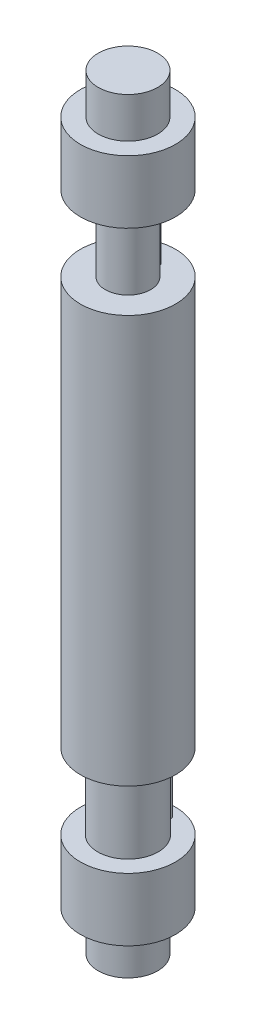
from build123d import *

# Parameters (mm, degrees)
SKETCH1_R           = 12.5
BOSS_EXTRUDE1_DEPTH = 17
SKETCH2_R           = 20
BOSS_EXTRUDE2_DEPTH = 26.425
SKETCH3_R           = 12.7
BOSS_EXTRUDE3_DEPTH = 31.75
SKETCH8_W           = 6.35
SKETCH8_H           = 3.175
BOSS_EXTRUDE8_DEPTH = 31.75
SKETCH4_R           = 20
BOSS_EXTRUDE4_DEPTH = 171.45
SKETCH5_R           = 9.525
BOSS_EXTRUDE5_DEPTH = 31.75
SKETCH9_W           = 4.7625
SKETCH9_H           = 2.38125
BOSS_EXTRUDE9_DEPTH = 31.75
SKETCH6_R           = 20
BOSS_EXTRUDE6_DEPTH = 26.425
SKETCH7_R           = 12.5
BOSS_EXTRUDE7_DEPTH = 17


with BuildPart() as part:
    # Sketch1 → Boss-Extrude1 (new body)
    with BuildSketch(Plane(origin=(0, 0, 0), x_dir=(1, 0, 0), z_dir=(0, 1, 0))):
        with Locations(Location((0, 0, 0), (0, 0, 270))):
            Circle(SKETCH1_R)
    extrude(amount=BOSS_EXTRUDE1_DEPTH)

    # Sketch2 → Boss-Extrude2 (add)
    with BuildSketch(Plane(origin=(0, 17, 0), x_dir=(1, 0, 0), z_dir=(0, 1, 0))):
        with Locations(Location((0, 0, 0), (0, 0, 270))):
            Circle(SKETCH2_R)
    extrude(amount=BOSS_EXTRUDE2_DEPTH)

    # Sketch3 → Boss-Extrude3 (add)
    with BuildSketch(Plane(origin=(0, 43.425, 0), x_dir=(1, 0, 0), z_dir=(0, 1, 0))):
        with Locations(Location((0, 0, 0), (0, 0, 270))):
            Circle(SKETCH3_R)
    extrude(amount=BOSS_EXTRUDE3_DEPTH)

    # Sketch8 → Boss-Extrude8 (add)
    with BuildSketch(Plane(origin=(0, 75.175, 0), x_dir=(1, 0, 0), z_dir=(0, 1, 0))):
        with Locations((0, 13.884222124)):
            Rectangle(SKETCH8_W, SKETCH8_H)
    extrude(amount=-BOSS_EXTRUDE8_DEPTH)

    # Sketch4 → Boss-Extrude4 (add)
    with BuildSketch(Plane(origin=(0, 75.175, 0), x_dir=(1, 0, 0), z_dir=(0, 1, 0))):
        with Locations(Location((0, 0, 0), (0, 0, 270))):
            Circle(SKETCH4_R)
    extrude(amount=BOSS_EXTRUDE4_DEPTH)

    # Sketch5 → Boss-Extrude5 (add)
    with BuildSketch(Plane(origin=(0, 246.625, 0), x_dir=(1, 0, 0), z_dir=(0, 1, 0))):
        with Locations(Location((0, 0, 0), (0, 0, 270))):
            Circle(SKETCH5_R)
    extrude(amount=BOSS_EXTRUDE5_DEPTH)

    # Sketch9 → Boss-Extrude9 (add)
    with BuildSketch(Plane(origin=(0, 278.375, 0), x_dir=(1, 0, 0), z_dir=(0, 1, 0))):
        with Locations((0, 10.413166593)):
            Rectangle(SKETCH9_W, SKETCH9_H)
    extrude(amount=-BOSS_EXTRUDE9_DEPTH)

    # Sketch6 → Boss-Extrude6 (add)
    with BuildSketch(Plane(origin=(0, 278.375, 0), x_dir=(1, 0, 0), z_dir=(0, 1, 0))):
        with Locations(Location((0, 0, 0), (0, 0, 270))):
            Circle(SKETCH6_R)
    extrude(amount=BOSS_EXTRUDE6_DEPTH)

    # Sketch7 → Boss-Extrude7 (add)
    with BuildSketch(Plane(origin=(0, 304.8, 0), x_dir=(1, 0, 0), z_dir=(0, 1, 0))):
        with Locations(Location((0, 0, 0), (0, 0, 270))):
            Circle(SKETCH7_R)
    extrude(amount=BOSS_EXTRUDE7_DEPTH)


solid = part.part
